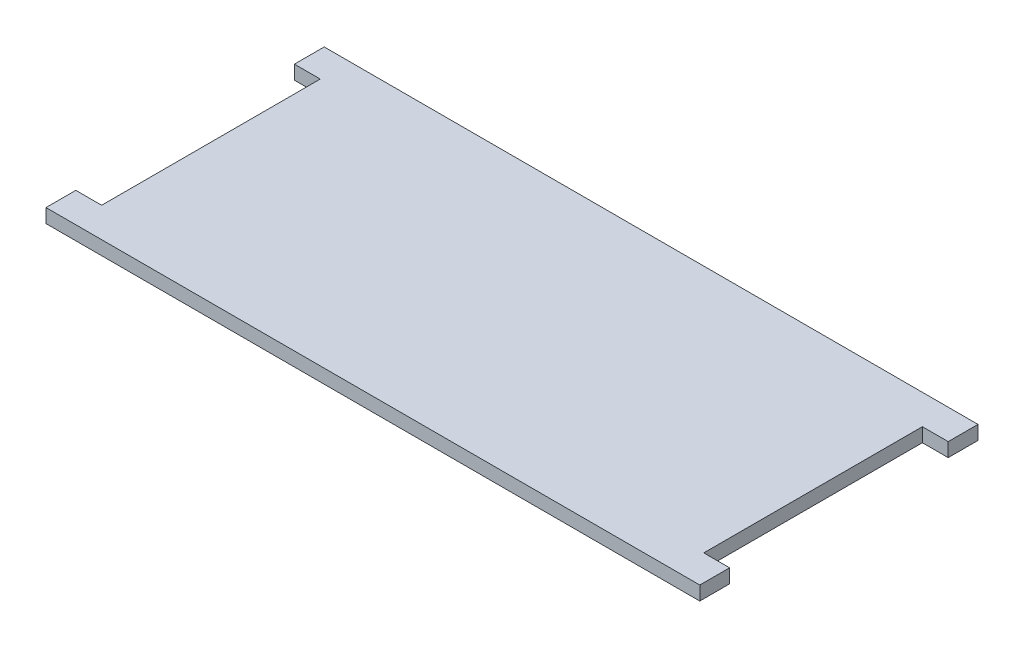
from build123d import *

# Parameters (mm, degrees)
ESQUISSE1_W             = 140
ESQUISSE1_H             = 7
BOSS_EXTRU_1_DEPTH      = 329
ESQUISSE2_W             = 303
ESQUISSE2_H             = 244.18
BOSS_EXTRU_2_DEPTH      = 7
ESQUISSE3_W             = 13
ESQUISSE3_H             = 110
ENL_V_MAT_EXTRU_1_DEPTH = 96
ENL_V_MAT_EXTRU_2_DEPTH = 96


with BuildPart() as part:
    # Esquisse1 → Boss.-Extru.1 (new body)
    with BuildSketch(Plane(origin=(0, 0, 0), x_dir=(0, 0, -1), z_dir=(1, 0, 0))):
        Rectangle(ESQUISSE1_W, ESQUISSE1_H)
    extrude(amount=BOSS_EXTRU_1_DEPTH)

    # Esquisse2 → Boss.-Extru.2 (add)
    with BuildSketch(Plane(origin=(0, 3.5, 0), x_dir=(1, 0, 0), z_dir=(0, 1, 0))):
        with Locations((164.5, 0)):
            Rectangle(ESQUISSE2_W, ESQUISSE2_H)
    extrude(amount=-BOSS_EXTRU_2_DEPTH)

    # Esquisse3 → Enlèv. mat.-Extru.1 (cut)
    with BuildSketch(Plane(origin=(0, 3.5, 0), x_dir=(1, 0, 0), z_dir=(0, 1, 0))):
        with Locations((6.5, 0)):
            Rectangle(ESQUISSE3_W, ESQUISSE3_H)
        with Locations((322.5, 0)):
            Rectangle(ESQUISSE3_W, ESQUISSE3_H)
    extrude(amount=-ENL_V_MAT_EXTRU_1_DEPTH, mode=Mode.SUBTRACT)

    # Esquisse4 → Enlèv. mat.-Extru.2 (cut)
    with BuildSketch(Plane(origin=(0, 3.5, 0), x_dir=(1, 0, 0), z_dir=(0, 1, 0))):
        Polygon((13, 70), (316, 70), (318.765325252, 132.447128924), (0, 132.447128924), align=None)
        Polygon((13, -70), (316, -70), (321.257609936, -130.666925578), (0, -142.41626766), align=None)
    extrude(amount=-ENL_V_MAT_EXTRU_2_DEPTH, mode=Mode.SUBTRACT)


solid = part.part
